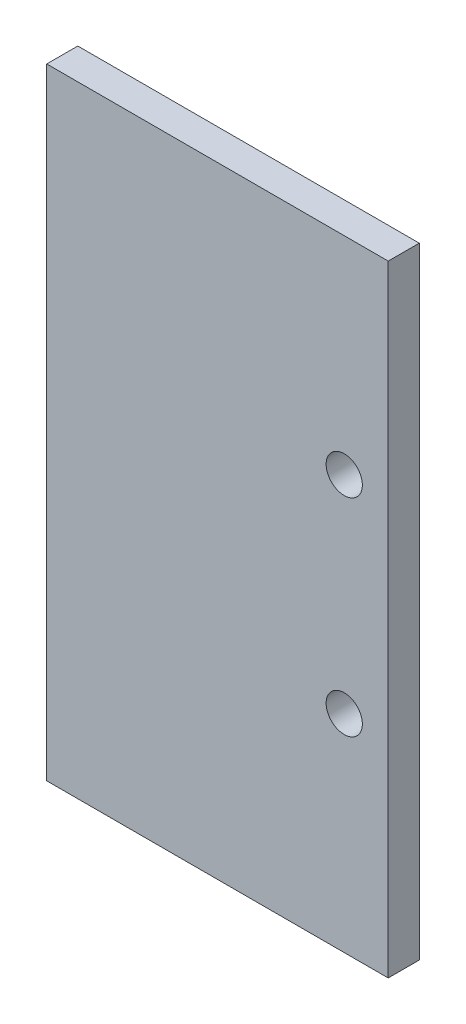
from build123d import *

# Parameters (mm, degrees)
ESQUISSE1_W             = 33
ESQUISSE1_H             = 60
BOSS_EXTRU_1_DEPTH      = 3
ESQUISSE3_R             = 3.75
BOSS_EXTRU_2_DEPTH      = 1.2
ESQUISSE4_R             = 1.75
ENL_V_MAT_EXTRU_1_DEPTH = 69.541957953


with BuildPart() as part:
    # Esquisse1 → Boss.-Extru.1 (new body)
    with BuildSketch(Plane.XY):
        with Locations((16.5, 30)):
            Rectangle(ESQUISSE1_W, ESQUISSE1_H)
    extrude(amount=BOSS_EXTRU_1_DEPTH)

    # Esquisse3 → Boss.-Extru.2 (add)
    with BuildSketch(Plane(origin=(0, 0, 0), x_dir=(-1, 0, 0), z_dir=(0, 0, -1))):
        with Locations((-3.75, 53)):
            Circle(ESQUISSE3_R)
        with Locations((-3.75, 7)):
            Circle(ESQUISSE3_R)
    extrude(amount=BOSS_EXTRU_2_DEPTH)

    # Esquisse4 → Enlèv. mat.-Extru.1 (cut, through all)
    with BuildSketch(Plane(origin=(0, 0, 0), x_dir=(-1, 0, 0), z_dir=(0, 0, -1))):
        with Locations((-28.75, 40)):
            Circle(ESQUISSE4_R)
        with Locations((-28.75, 20)):
            Circle(ESQUISSE4_R)
    extrude(amount=-ENL_V_MAT_EXTRU_1_DEPTH, mode=Mode.SUBTRACT)


solid = part.part
